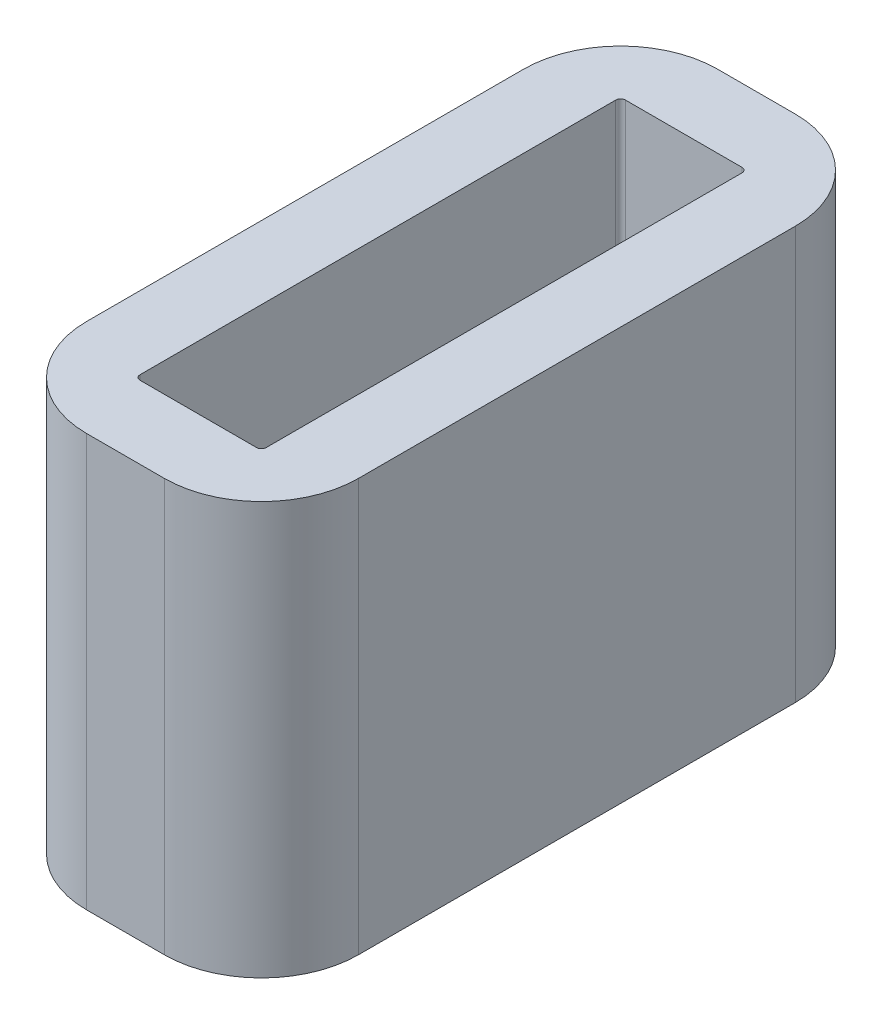
from build123d import *

# Parameters (mm, degrees)
COIL_START = -0.7
SKETCH1_W  = 2.6
SKETCH1_H  = 10
COIL_DEPTH = 8.5
FILLET1_R  = 0.1


with BuildPart() as part:
    # Sketch1 → Coil (new body)
    with BuildSketch(Plane(origin=(0, 97.279475289, 0), x_dir=(1, 0, 0), z_dir=(0, 1, 0)).offset(COIL_START)):
        with BuildLine():
            Line((88.272792821, 72.609367759), (89.872792821, 72.609367759))
            ThreePointArc((89.872792821, 72.609367759), (91.287006384, 73.195154196), (91.872792821, 74.609367759))
            Line((91.872792821, 74.609367759), (91.872792821, 83.609367759))
            ThreePointArc((91.872792821, 83.609367759), (91.287006384, 85.023581321), (89.872792821, 85.609367759))
            Line((89.872792821, 85.609367759), (88.272792821, 85.609367759))
            ThreePointArc((88.272792821, 85.609367759), (86.858579259, 85.023581321), (86.272792821, 83.609367759))
            Line((86.272792821, 83.609367759), (86.272792821, 74.609367759))
            ThreePointArc((86.272792821, 74.609367759), (86.858579259, 73.195154196), (88.272792821, 72.609367759))
        make_face()
        with Locations((89.072792821, 79.109367759)):
            Rectangle(SKETCH1_W, SKETCH1_H, mode=Mode.SUBTRACT)
    extrude(amount=-COIL_DEPTH)

    # Fillet1
    fillet1_edges = [part.edges().sort_by_distance(p)[0] for p in [
        (90.372792821, 92.329475289, -84.109367759),
        (90.372792821, 92.329475289, -74.109367759),
        (87.772792821, 92.329475289, -74.109367759),
        (87.772792821, 92.329475289, -84.109367759),
    ]]
    fillet(fillet1_edges, radius=FILLET1_R)


solid = part.part
